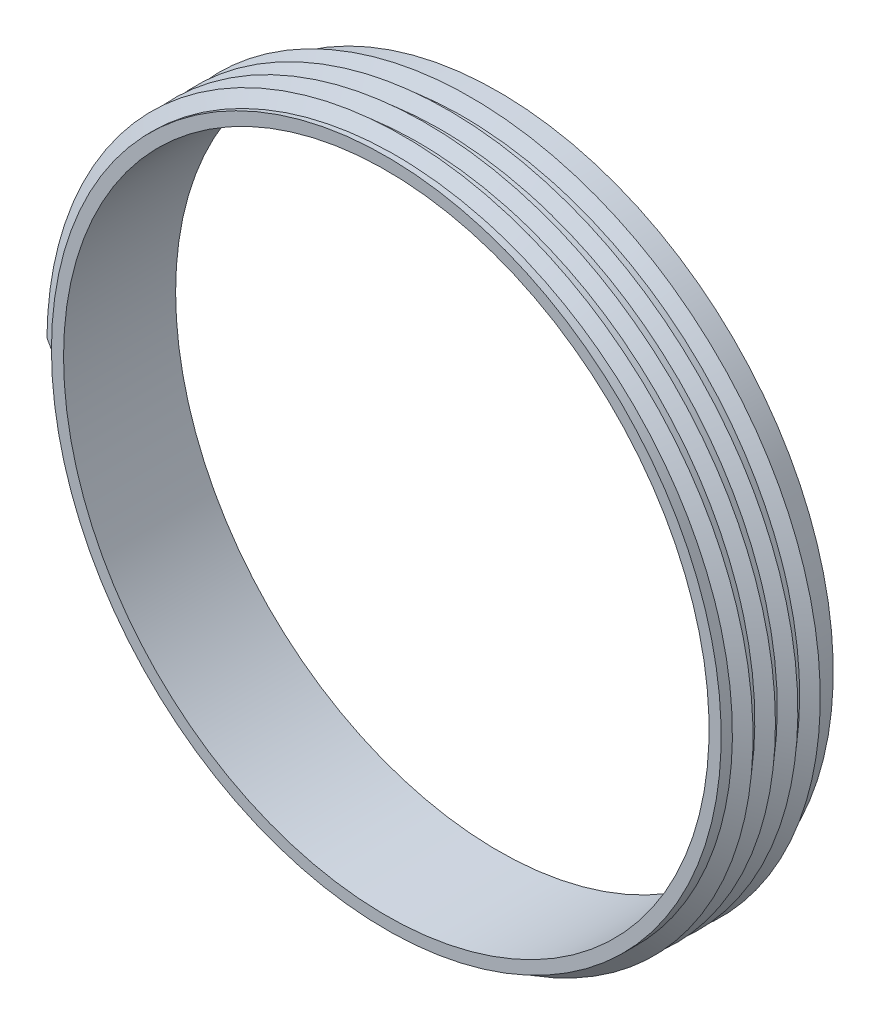
from build123d import *

# Parameters (mm, degrees)
SKETCH22_R          = 37.35
SKETCH22_R_2        = 36
BOSS_EXTRUDE6_DEPTH = 12.5
SWEEP1_PITCH        = 2.5
SWEEP1_HEIGHT       = 10
SWEEP1_RADIUS       = 37.35


with BuildPart() as part:
    # Sketch22 → Boss-Extrude6 (new body)
    with BuildSketch(Plane(origin=(0, 0, 0), x_dir=(-1, 0, 0), z_dir=(0, 0, -1))):
        Circle(SKETCH22_R)
        Circle(SKETCH22_R_2, mode=Mode.SUBTRACT)
    extrude(amount=BOSS_EXTRUDE6_DEPTH)

    # Sweep1: sweep along a helix
    with BuildLine() as sweep1_path:
        Helix(SWEEP1_PITCH, SWEEP1_HEIGHT, SWEEP1_RADIUS, center=(0, 0, 0), direction=(0, 0, -1))
    # Sketch31 → Sweep1 (sweep)
    with BuildSketch(Plane(origin=(0, 0, 0), x_dir=(1, 0, 0), z_dir=(0, 1, 0))):
        Polygon((-37.35, 0), (-36.35, 0), (-36.35, 1.8), (-37.35, 1.8), (-38.75, 0.9), align=None)
    sweep(path=sweep1_path.line, is_frenet=True)


solid = part.part
